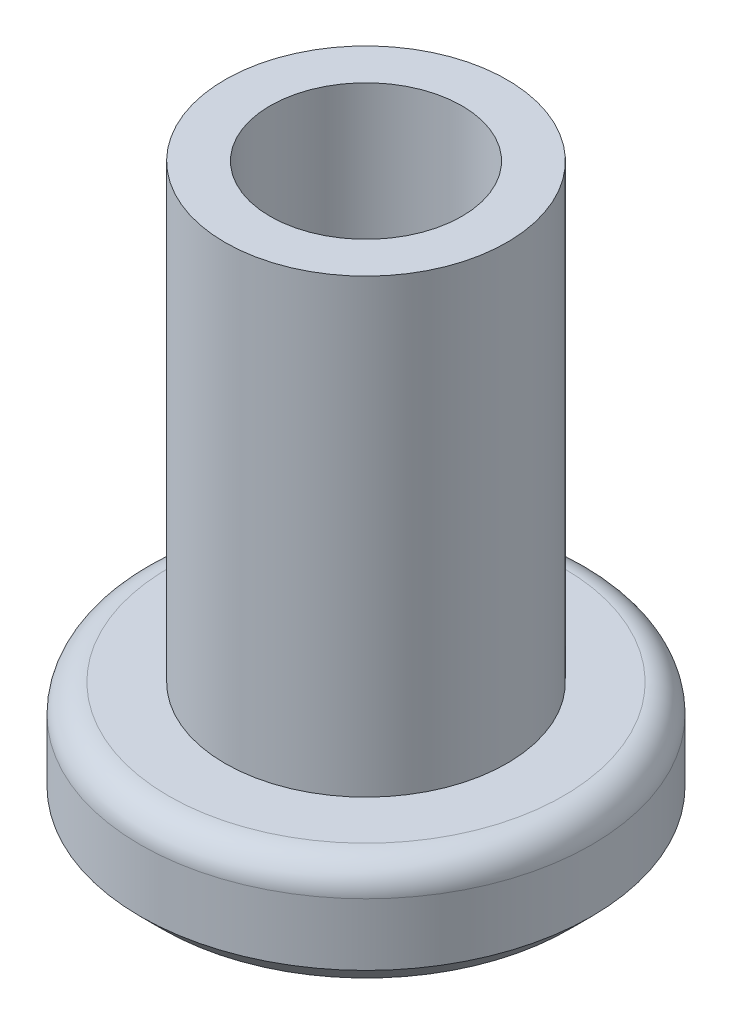
from build123d import *

# Parameters (mm, degrees)
SKETCH1_R           = 2.5
SKETCH1_R_2         = 1.7
BOSS_EXTRUDE1_DEPTH = 8
BOSS_EXTRUDE2_START = -2
SKETCH1_3_R         = 4
SKETCH1_3_R_2       = 3
SKETCH1_3_R_3       = 2.5
SKETCH1_3_R_4       = 1.7
BOSS_EXTRUDE2_DEPTH = 2
FILLET1_R           = 0.5
CHAMFER1_SIZE       = 0.4


with BuildPart() as part:
    # Sketch1 → Boss-Extrude1 (new body)
    with BuildSketch(Plane(origin=(0, 0, 0), x_dir=(1, 0, 0), z_dir=(0, 1, 0))):
        with Locations(Location((0, 0, 0), (0, 0, 270))):
            Circle(SKETCH1_R)
        with Locations(Location((0, 0, 0), (0, 0, 270))):
            Circle(SKETCH1_R_2, mode=Mode.SUBTRACT)
    extrude(amount=BOSS_EXTRUDE1_DEPTH)

    # Sketch1<3> → Boss-Extrude2 (add)
    # profile 1 of 3: a face of its own
    with BuildSketch(Plane(origin=(0, 0, 0), x_dir=(1, 0, 0), z_dir=(0, 1, 0)).offset(BOSS_EXTRUDE2_START)):
        with Locations(Location((0, 0, 0), (0, 0, 270))):
            Circle(SKETCH1_3_R)
        Circle(SKETCH1_3_R_2, mode=Mode.SUBTRACT)
    # profile 2 of 3: a face of its own
    with BuildSketch(Plane(origin=(0, 0, 0), x_dir=(1, 0, 0), z_dir=(0, 1, 0)).offset(BOSS_EXTRUDE2_START)):
        Circle(SKETCH1_3_R_2)
        with Locations(Location((0, 0, 0), (0, 0, 270))):
            Circle(SKETCH1_3_R_3, mode=Mode.SUBTRACT)
    # profile 3 of 3: a face of its own
    with BuildSketch(Plane(origin=(0, 0, 0), x_dir=(1, 0, 0), z_dir=(0, 1, 0)).offset(BOSS_EXTRUDE2_START)):
        with Locations(Location((0, 0, 0), (0, 0, 270))):
            Circle(SKETCH1_3_R_3)
        with Locations(Location((0, 0, 0), (0, 0, 270))):
            Circle(SKETCH1_3_R_4, mode=Mode.SUBTRACT)
    extrude(amount=BOSS_EXTRUDE2_DEPTH)

    # Fillet1
    fillet1_edges = [part.edges().sort_by_distance(p)[0] for p in [
        (0, 0, -4),
    ]]
    fillet(fillet1_edges, radius=FILLET1_R)

    # Chamfer1
    chamfer1_edges = [part.edges().sort_by_distance(p)[0] for p in [
        (0, -2, -4),
        (0, -2, -1.7),
    ]]
    chamfer(chamfer1_edges, length=CHAMFER1_SIZE)


solid = part.part
